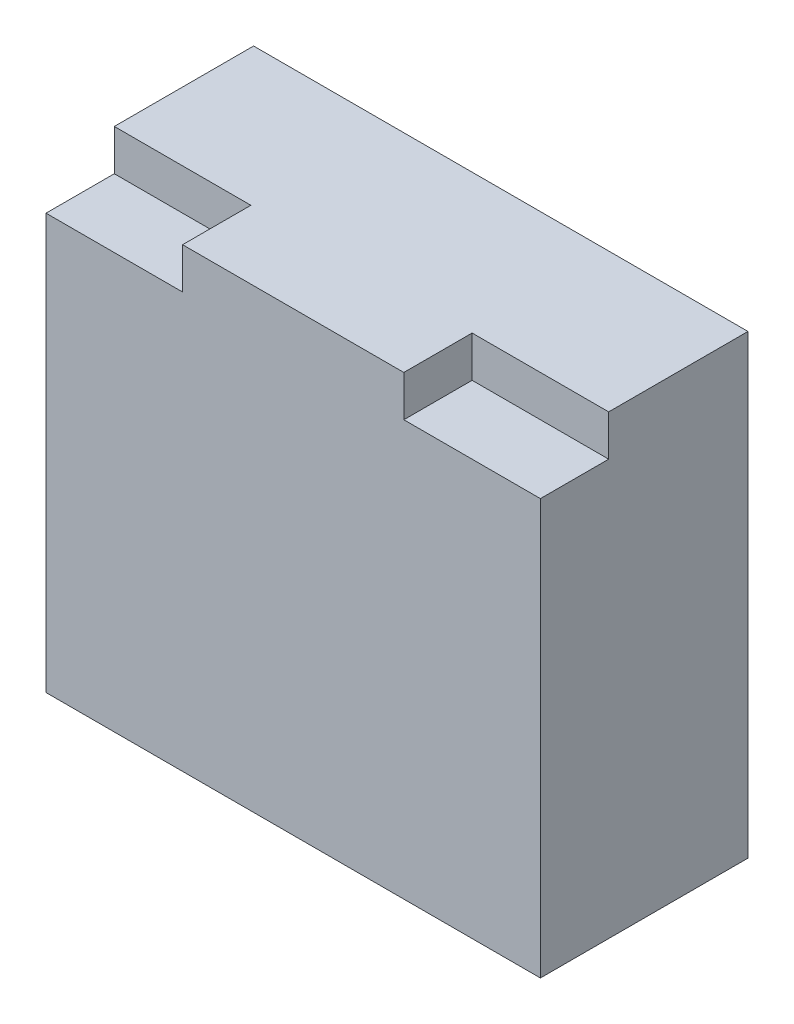
from build123d import *

# Parameters (mm, degrees)
SKETCH1_W           = 181
SKETCH1_H           = 76
BOSS_EXTRUDE1_DEPTH = 167
SKETCH3_W           = 50
SKETCH3_H           = 25
CUT_EXTRUDE2_DEPTH  = 15


with BuildPart() as part:
    # Sketch1 → Boss-Extrude1 (new body)
    with BuildSketch(Plane(origin=(0, 0, 0), x_dir=(1, 0, 0), z_dir=(0, 1, 0))):
        with Locations((90.5, -38)):
            Rectangle(SKETCH1_W, SKETCH1_H)
    extrude(amount=BOSS_EXTRUDE1_DEPTH)

    # Sketch3 → Cut-Extrude2 (cut)
    with BuildSketch(Plane(origin=(0, 167, 0), x_dir=(1, 0, 0), z_dir=(0, 1, 0))):
        with Locations((156, -63.5)):
            Rectangle(SKETCH3_W, SKETCH3_H)
        with Locations((25, -63.5)):
            Rectangle(SKETCH3_W, SKETCH3_H)
    extrude(amount=-CUT_EXTRUDE2_DEPTH, mode=Mode.SUBTRACT)


solid = part.part
